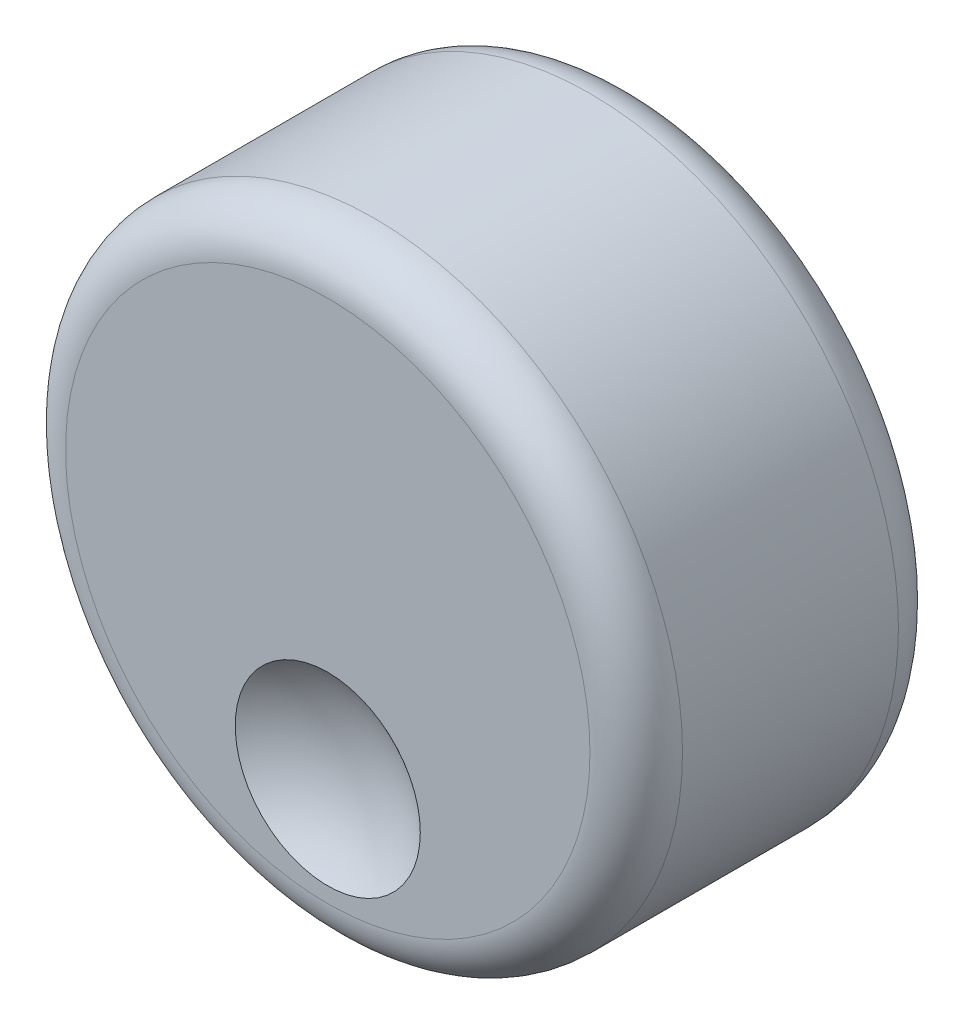
from build123d import *

# Parameters (mm, degrees)
SKETCH1_R           = 10
BOSS_EXTRUDE1_DEPTH = 10
FILLET1_R           = 1.5
SKETCH2_R           = 3
CUT_EXTRUDE1_DEPTH  = 8
CHAMFER1_SIZE       = 1


with BuildPart() as part:
    # Sketch1 → Boss-Extrude1 (new body)
    with BuildSketch(Plane.XY):
        Circle(SKETCH1_R)
    extrude(amount=BOSS_EXTRUDE1_DEPTH)

    # Fillet1
    fillet1_edges = [part.edges().sort_by_distance(p)[0] for p in [
        (-10, 0, 0),
        (-10, 0, 10),
    ]]
    fillet(fillet1_edges, radius=FILLET1_R)

    # Sketch2 → Cut-Extrude1 (cut)
    with BuildSketch(Plane(origin=(0, 0, 0), x_dir=(-1, 0, 0), z_dir=(0, 0, -1))):
        Circle(SKETCH2_R)
    extrude(amount=-CUT_EXTRUDE1_DEPTH, mode=Mode.SUBTRACT)

    # Chamfer1
    chamfer1_edges = [part.edges().sort_by_distance(p)[0] for p in [
        (3, 0, 0),
    ]]
    chamfer(chamfer1_edges, length=CHAMFER1_SIZE)

    # Sketch3 → Cut-Revolve2 (revolve, cut)
    with BuildSketch(Plane(origin=(0, 0, 0), x_dir=(0, 0, -1), z_dir=(1, 0, 0))):
        with BuildLine():
            Line((-19, -5), (-9, -5))
            ThreePointArc((-9, -5), (-14, -10), (-19, -5))
        make_face()
    revolve(axis=Axis((0, -5, 19), (0, 0, -1)), mode=Mode.SUBTRACT)


solid = part.part
